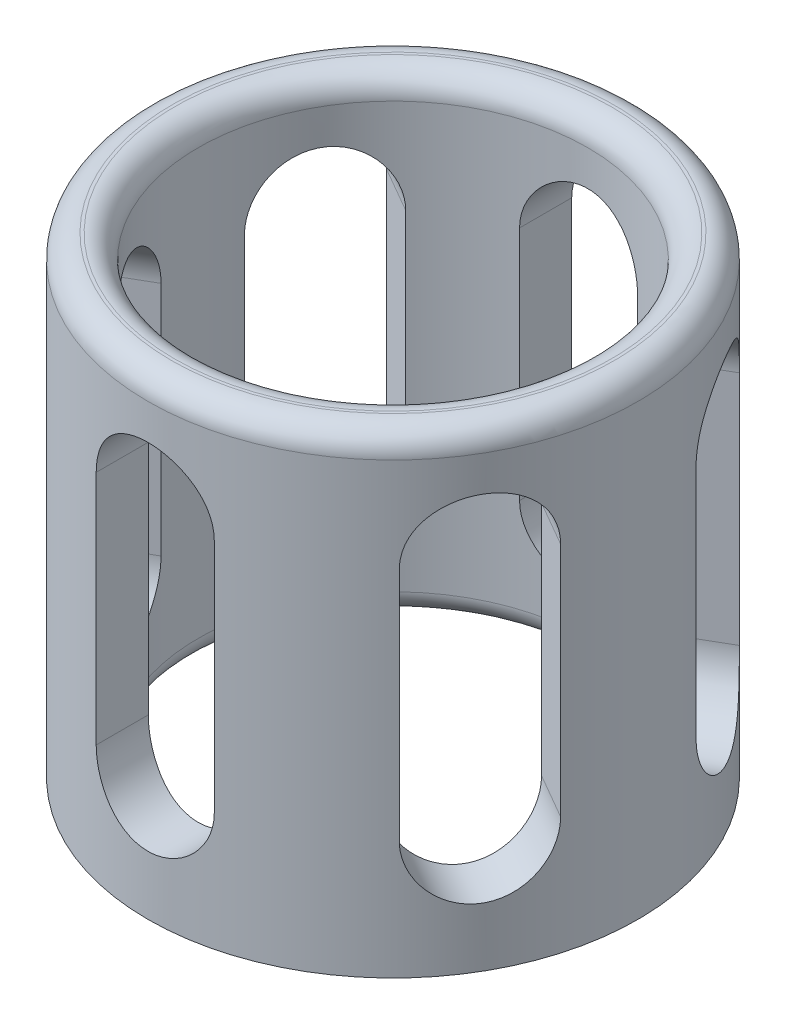
from build123d import *

# Parameters (mm, degrees)
SKETCH1_R           = 20.75
SKETCH1_R_2         = 16.5
BOSS_EXTRUDE1_DEPTH = 40
CUT_EXTRUDE1_DEPTH  = 20
CIRPATTERN1_COUNT   = 6
FILLET1_R           = 2


with BuildPart() as part:
    # Sketch1 → Boss-Extrude1 (new body)
    with BuildSketch(Plane(origin=(0, 0, 0), x_dir=(1, 0, 0), z_dir=(0, 1, 0))):
        Circle(SKETCH1_R)
        Circle(SKETCH1_R_2, mode=Mode.SUBTRACT)
    extrude(amount=BOSS_EXTRUDE1_DEPTH)

    # Sketch2 → Cut-Extrude1 (cut)
    with BuildSketch(Plane.XY.offset(20.75)):
        with BuildLine():
            ThreePointArc((5, 30), (0, 35), (-5, 30))
            Line((-5, 30), (-5, 10))
            ThreePointArc((-5, 10), (0, 5), (5, 10))
            Line((5, 10), (5, 30))
        make_face()
    cut_extrude1 = extrude(amount=-CUT_EXTRUDE1_DEPTH, mode=Mode.SUBTRACT)

    # CirPattern1: Cut-Extrude1 ×6 about axis
    cirpattern1_axis = Axis((0, 40, 0), (0, -1, 0))
    for i in range(1, CIRPATTERN1_COUNT):
        add(cut_extrude1.rotate(cirpattern1_axis, i * 360 / CIRPATTERN1_COUNT), mode=Mode.SUBTRACT)

    # Fillet1
    fillet1_edges = [part.edges().sort_by_distance(p)[0] for p in [
        (-20.75, 40, 0),
        (-16.5, 0, 0),
        (-16.5, 40, 0),
    ]]
    fillet(fillet1_edges, radius=FILLET1_R)


solid = part.part
